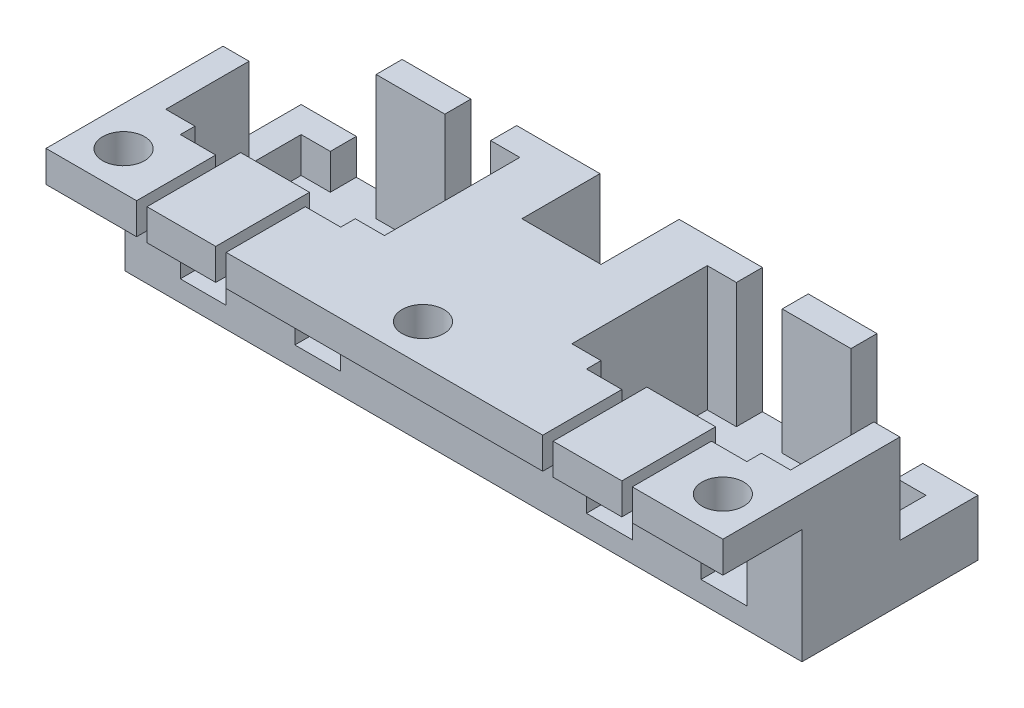
from build123d import *

# Parameters (mm, degrees)
SKETCH1_W              = 82.55
SKETCH1_H              = 21.463
PLATE_DEPTH            = 1.27
SKETCH4_W              = 82.55
SKETCH4_H              = 15.24
BOSS_EXTRUDE1_DEPTH    = 1.778
SKETCH5_W              = 3.175
SKETCH5_H              = 15.24
BOSS_EXTRUDE2_DEPTH    = 19.685
BOSS_EXTRUDE5_REACH    = 84.613
SKETCH9_W              = 3.175
SKETCH9_H              = 15.24
BOSS_EXTRUDE6_REACH    = 50.618
SKETCH11_W             = 5.588
SKETCH11_H             = 15.24
CUT_EXTRUDE1_DEPTH     = 50.364623912
SKETCH13_W             = 82.55
SKETCH13_H             = 3.81
BOSS_EXTRUDE7_DEPTH    = 9.652
F_10_CLEARANCE_HOLE1_D = 5.1054
SKETCH16_W             = 6.985
SKETCH16_H             = 10.922
SKETCH16_W_2           = 9.652
CUT_EXTRUDE4_DEPTH     = 9.525
SKETCH18_W             = 1.27
SKETCH18_H             = 9.652
CUT_EXTRUDE6_DEPTH     = 52.685411423


with BuildPart() as part:
    # Sketch1 → Plate (new, symmetric)
    with BuildSketch(Plane(origin=(0, 0, 0), x_dir=(1, 0, 0), z_dir=(0, 1, 0))):
        with Locations((0, -5.1435)):
            Rectangle(SKETCH1_W, SKETCH1_H)
    extrude(amount=PLATE_DEPTH, both=True)

    # Sketch4 → Boss-Extrude1 (add)
    with BuildSketch(Plane.XY.offset(15.875)):
        with Locations((0, 8.89)):
            Rectangle(SKETCH4_W, SKETCH4_H)
    extrude(amount=-BOSS_EXTRUDE1_DEPTH)

    # Sketch5 → Boss-Extrude2 (add)
    with BuildSketch(Plane(origin=(0, 0, 14.097), x_dir=(-1, 0, 0), z_dir=(0, 0, -1))):
        with Locations((-39.6875, 8.89)):
            Rectangle(SKETCH5_W, SKETCH5_H)
        with Locations((39.6875, 8.89)):
            Rectangle(SKETCH5_W, SKETCH5_H)
    extrude(amount=BOSS_EXTRUDE2_DEPTH)

    # Sketch9 → Boss-Extrude5 (add, up to next)
    with BuildSketch(Plane.ZY.offset(-38.1), mode=Mode.PRIVATE) as boss_extrude5_sk1:
        with Locations((-4.0005, 8.89)):
            Rectangle(SKETCH9_W, SKETCH9_H)
    boss_extrude5_tool1 = extrude(boss_extrude5_sk1.sketch, amount=BOSS_EXTRUDE5_REACH, mode=Mode.PRIVATE) - part.part
    add(boss_extrude5_tool1.solids().sort_by_distance((38.1, 8.89, -4.0005))[0])

    # Sketch10 → Boss-Extrude6 (add, up to next)
    with BuildSketch(Plane(origin=(0, 0, 14.097), x_dir=(-1, 0, 0), z_dir=(0, 0, -1)), mode=Mode.PRIVATE) as boss_extrude6_sk1:
        Polygon((-8.255, 1.27), (-11.43, 1.27), (-11.43, 16.51), (-8.255, 16.51), (8.255, 16.51), (11.43, 16.51), (11.43, 1.27), (8.255, 1.27), align=None)
    boss_extrude6_tool1 = extrude(boss_extrude6_sk1.sketch, amount=BOSS_EXTRUDE6_REACH, mode=Mode.PRIVATE) - part.part
    add(boss_extrude6_tool1.solids().sort_by_distance((0, 8.89, 14.097))[0])

    # Sketch11 → Cut-Extrude1 (cut, through all)
    with BuildSketch(Plane(origin=(0, 0, -5.588), x_dir=(-1, 0, 0), z_dir=(0, 0, -1))):
        with Locations((-31.75, 8.89)):
            Rectangle(SKETCH11_W, SKETCH11_H)
        with Locations((31.75, 8.89)):
            Rectangle(SKETCH11_W, SKETCH11_H)
        with Locations((-17.78, 8.89)):
            Rectangle(SKETCH11_W, SKETCH11_H)
        with Locations((17.78, 8.89)):
            Rectangle(SKETCH11_W, SKETCH11_H)
    extrude(amount=-CUT_EXTRUDE1_DEPTH, mode=Mode.SUBTRACT)

    # Sketch13 → Boss-Extrude7 (add)
    with BuildSketch(Plane.XY.offset(15.875)):
        with Locations((0, 14.605)):
            Rectangle(SKETCH13_W, SKETCH13_H)
    extrude(amount=BOSS_EXTRUDE7_DEPTH)

    # #10 Clearance Hole1 (through all)
    with Locations(Plane(origin=(36.5125, 16.51, 20.7645), x_dir=(0, 0, 1), z_dir=(0, 1, 0))):
        with Locations((0, 0), (0.0635, -36.5125), (0.0635, -73.025)):
            Hole(F_10_CLEARANCE_HOLE1_D / 2)

    # Sketch16 → Cut-Extrude4 (cut)
    with BuildSketch(Plane(origin=(0, 0, -5.588), x_dir=(-1, 0, 0), z_dir=(0, 0, -1))):
        with Locations((-37.7825, 11.049)):
            Rectangle(SKETCH16_W, SKETCH16_H)
        with Locations((37.7825, 11.049)):
            Rectangle(SKETCH16_W, SKETCH16_H)
        with Locations((0, 11.049)):
            Rectangle(SKETCH16_W_2, SKETCH16_H)
    extrude(amount=-CUT_EXTRUDE4_DEPTH, mode=Mode.SUBTRACT)

    # Sketch18 → Cut-Extrude6 (cut, through all)
    with BuildSketch(Plane(origin=(0, 16.51, 0), x_dir=(1, 0, 0), z_dir=(0, 1, 0))):
        with Locations((-29.591, -20.701)):
            Rectangle(SKETCH18_W, SKETCH18_H)
        with Locations((-19.939, -20.701)):
            Rectangle(SKETCH18_W, SKETCH18_H)
        with Locations((19.939, -20.701)):
            Rectangle(SKETCH18_W, SKETCH18_H)
        with Locations((29.591, -20.701)):
            Rectangle(SKETCH18_W, SKETCH18_H)
    extrude(amount=-CUT_EXTRUDE6_DEPTH, mode=Mode.SUBTRACT)


solid = part.part
